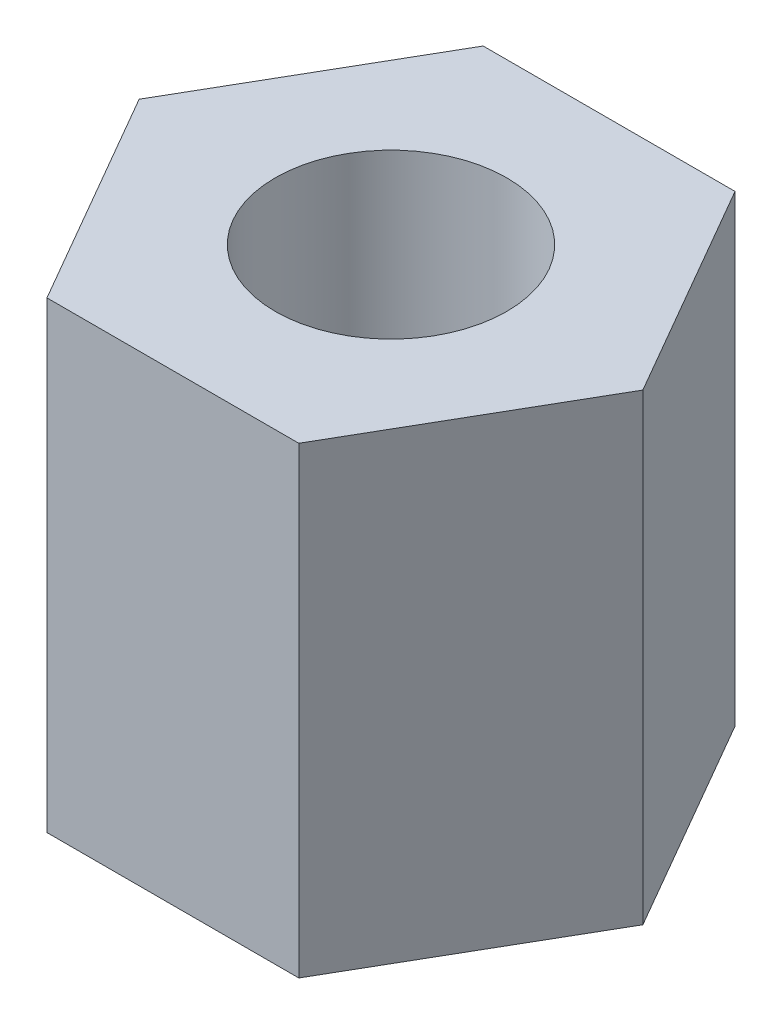
from build123d import *

# Parameters (mm, degrees)
EXTRUDE_1_DEPTH    = 5
HOLE_WIZARD_M3_1_D = 2.5


with BuildPart() as part:
    # 草图1 → 凸台-拉伸1 (new body)
    with BuildSketch(Plane(origin=(0, 0, 0), x_dir=(1, 0, 0), z_dir=(0, 1, 0))):
        Polygon((2.719319768, 0), (1.359659884, 2.355), (-1.359659884, 2.355), (-2.719319768, 0), (-1.359659884, -2.355), (1.359659884, -2.355), align=None)
    extrude(amount=EXTRUDE_1_DEPTH)

    # M3 螺纹孔1 (through all)
    with Locations(Plane(origin=(0, 5, 0), x_dir=(1, 0, 0), z_dir=(0, 1, 0))):
        with Locations((0, 0)):
            Hole(HOLE_WIZARD_M3_1_D / 2)


solid = part.part
